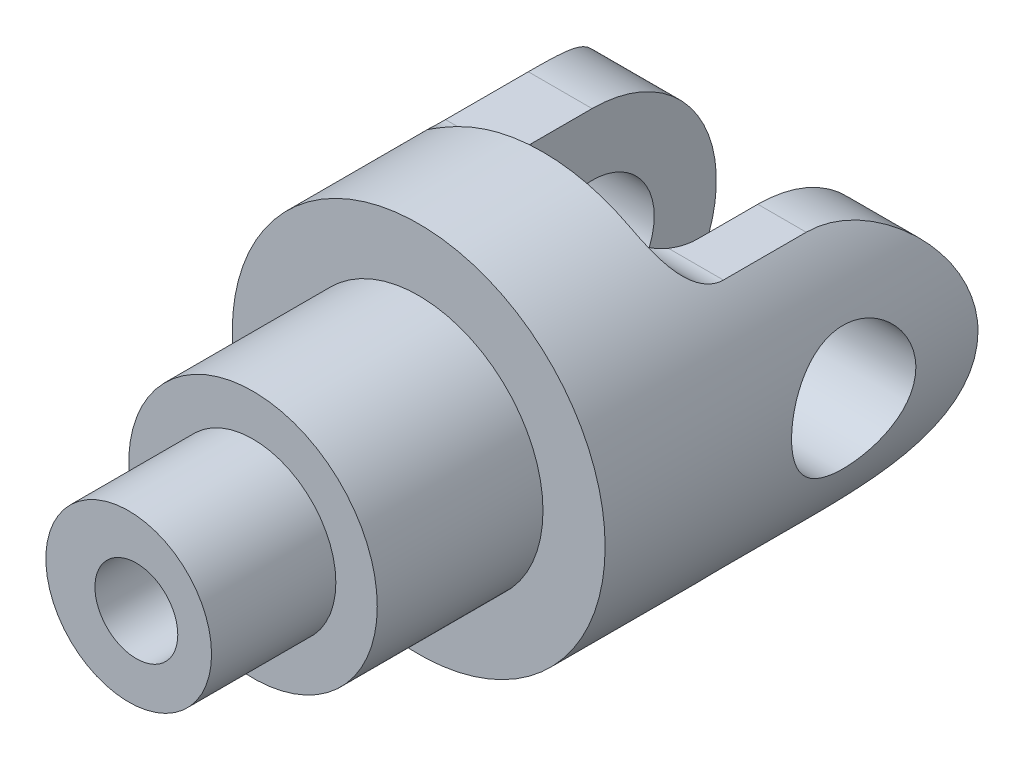
from build123d import *

# Parameters (mm, degrees)
SKETCH2_R          = 10
CUT_EXTRUDE1_DEPTH = 216
CUT_EXTRUDE2_DEPTH = 108
CUT_EXTRUDE3_DEPTH = 108
SKETCH7_R          = 15
CUT_EXTRUDE4_DEPTH = 108


with BuildPart() as part:
    # Sketch1 → Revolve1 (revolve)
    with BuildSketch(Plane(origin=(0, 0, 0), x_dir=(1, 0, 0), z_dir=(0, 1, 0)), mode=Mode.PRIVATE) as revolve1_sk:
        Polygon((-1.846866082, -35.985748219), (-1.846866082, 124.014251781), (-46.846866082, 124.014251781), (-46.846866082, 34.014251781), (-31.846866082, 34.014251781), (-31.846866082, -5.985748219), (-21.846866082, -5.985748219), (-21.846866082, -35.985748219), align=None)
    revolve(revolve1_sk.sketch.rotate(Axis((-1.846866082, 0, 35.985748219), (0, 0, -1)), 180), axis=Axis((-1.846866082, 0, 35.985748219), (0, 0, -1)))

    # Sketch2 → Cut-Extrude1 (cut)
    with BuildSketch(Plane.XY.offset(35.985748219)):
        Circle(SKETCH2_R)
    extrude(amount=-CUT_EXTRUDE1_DEPTH, mode=Mode.SUBTRACT)

    # Sketch4 → Cut-Extrude2 (cut, symmetric)
    with BuildSketch(Plane(origin=(0, 0, 0), x_dir=(0, 0, -1), z_dir=(1, 0, 0))):
        with BuildLine():
            Line((124.014251781, 45), (64.014251781, 45))
            Line((64.014251781, 45), (64.014251781, 40))
            ThreePointArc((64.014251781, 40), (66.94318397, 32.928932188), (74.014251781, 30))
            Line((74.014251781, 30), (94.014251781, 30))
            ThreePointArc((94.014251781, 30), (115.227455222, 21.213203431), (124.014251781, -1.4e-08))
            Line((124.014251781, -1.4e-08), (124.014251781, 45))
        make_face()
        with BuildLine():
            Line((124.014251781, -45), (124.014251781, -1.4e-08))
            ThreePointArc((124.014251781, -1.4e-08), (115.227455212, -21.213203441), (94.014251781, -30))
            Line((94.014251781, -30), (74.014251781, -30))
            ThreePointArc((74.014251781, -30), (66.94318397, -32.928932188), (64.014251781, -40))
            Line((64.014251781, -40), (64.014251781, -45))
            Line((64.014251781, -45), (124.014251781, -45))
        make_face()
    extrude(amount=CUT_EXTRUDE2_DEPTH, both=True, mode=Mode.SUBTRACT)

    # Sketch5 → Cut-Extrude3 (cut, symmetric)
    with BuildSketch(Plane(origin=(0, -30, 0), x_dir=(-1, 0, 0), z_dir=(0, -1, 0))):
        with BuildLine():
            Line((-20, 129.367247505), (20, 129.367247505))
            Line((20, 129.367247505), (20, 79.367247505))
            ThreePointArc((20, 79.367247505), (17.071067812, 72.296179693), (10, 69.367247505))
            Line((10, 69.367247505), (-10, 69.367247505))
            ThreePointArc((-10, 69.367247505), (-17.071067812, 72.296179693), (-20, 79.367247505))
            Line((-20, 79.367247505), (-20, 129.367247505))
        make_face()
    extrude(amount=CUT_EXTRUDE3_DEPTH, both=True, mode=Mode.SUBTRACT)

    # Sketch7 → Cut-Extrude4 (cut, symmetric)
    with BuildSketch(Plane(origin=(0, 0, 0), x_dir=(0, 0, -1), z_dir=(1, 0, 0))):
        with Locations((94.014251781, 0)):
            Circle(SKETCH7_R)
    extrude(amount=CUT_EXTRUDE4_DEPTH, both=True, mode=Mode.SUBTRACT)


solid = part.part
